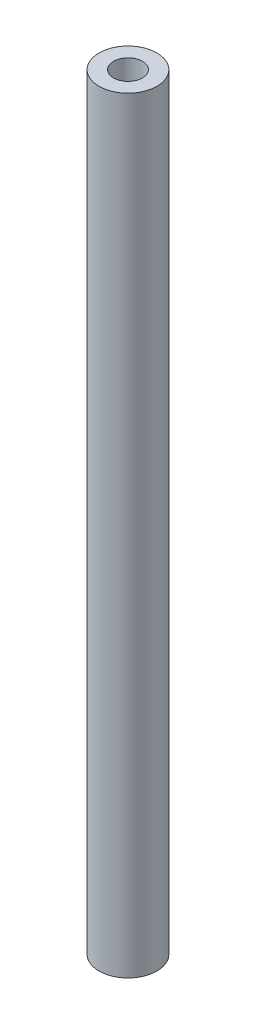
from build123d import *

# Parameters (mm, degrees)
SKETCH1_R           = 2
SKETCH1_R_2         = 1
BOSS_EXTRUDE1_DEPTH = 53


with BuildPart() as part:
    # Sketch1 → Boss-Extrude1 (new body)
    with BuildSketch(Plane(origin=(0, 0, 0), x_dir=(1, 0, 0), z_dir=(0, 1, 0))):
        with Locations(Location((0, 0, 0), (0, 0, 270))):
            Circle(SKETCH1_R)
        with Locations(Location((0, 0, 0), (0, 0, 270))):
            Circle(SKETCH1_R_2, mode=Mode.SUBTRACT)
    extrude(amount=BOSS_EXTRUDE1_DEPTH)


solid = part.part
